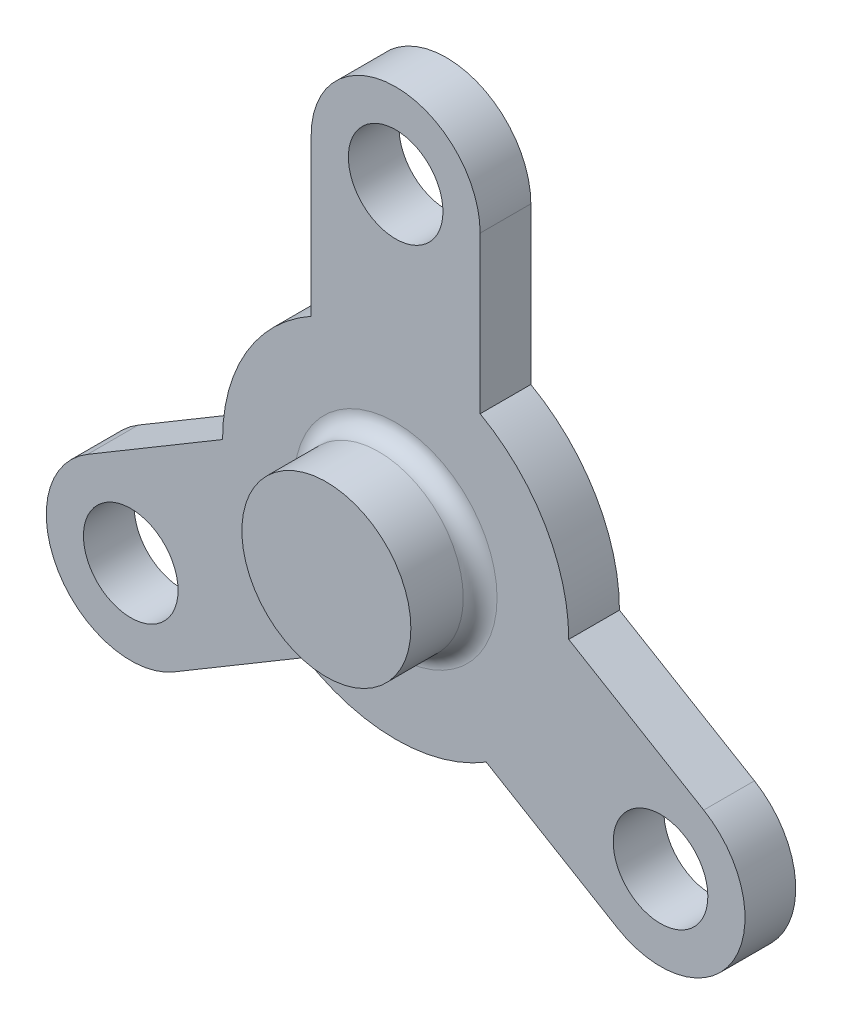
from build123d import *

# Parameters (mm, degrees)
SALIENTE_EXTRUIR1_DEPTH = 3
CROQUIS2_R              = 2.8
CORTAR_EXTRUIR3_DEPTH   = 5.5
CROQUIS3_R              = 5
SALIENTE_EXTRUIR2_DEPTH = 4.1
REDONDEO1_R             = 1


with BuildPart() as part:
    # Croquis1 → Saliente-Extruir1 (new body)
    with BuildSketch(Plane.XY):
        with BuildLine():
            Line((-13.118348224, -13.346885602), (-5.358962429, -8.729934305))
            ThreePointArc((-5.358962429, -8.729934305), (0, -10.243545836), (5.358962429, -8.729934305))
            Line((5.358962429, -8.729934305), (13.118348224, -13.346885602))
            ThreePointArc((13.118348224, -13.346885602), (19.97194541, -11.606711584), (18.231771393, -4.753114398))
            Line((18.231771393, -4.753114398), (10.243545836, 0))
            ThreePointArc((10.243545836, 0), (8.83594818, 5.182301714), (5, 8.94037087))
            Line((5, 8.94037087), (5, 18.2))
            ThreePointArc((5, 18.2), (0, 23.2), (-5, 18.2))
            Line((-5, 18.2), (-5, 8.94037087))
            ThreePointArc((-5, 8.94037087), (-8.83594818, 5.182301714), (-10.243545836, 0))
            Line((-10.243545836, 0), (-18.231771393, -4.753114398))
            ThreePointArc((-18.231771393, -4.753114398), (-19.97194541, -11.606711584), (-13.118348224, -13.346885602))
        make_face()
    extrude(amount=SALIENTE_EXTRUIR1_DEPTH)

    # Croquis2 → Cortar-Extruir3 (cut)
    with BuildSketch(Plane.XY.offset(3)):
        with Locations((0, 18.2)):
            Circle(CROQUIS2_R)
        with Locations((15.675059808, -9.05)):
            Circle(CROQUIS2_R)
        with Locations((-15.675059808, -9.05)):
            Circle(CROQUIS2_R)
    extrude(amount=-CORTAR_EXTRUIR3_DEPTH, mode=Mode.SUBTRACT)

    # Croquis3 → Saliente-Extruir2 (add)
    with BuildSketch(Plane.XY.offset(3)):
        Circle(CROQUIS3_R)
    extrude(amount=SALIENTE_EXTRUIR2_DEPTH)

    # Redondeo1
    redondeo1_edges = [part.edges().sort_by_distance(p)[0] for p in [
        (-5, 0, 3),
    ]]
    fillet(redondeo1_edges, radius=REDONDEO1_R)


solid = part.part
